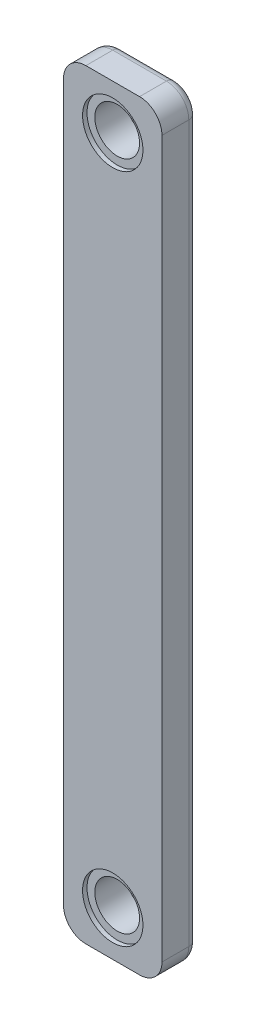
from build123d import *

# Parameters (mm, degrees)
SKETCH1_W           = 22
SKETCH1_H           = 170
BOSS_EXTRUDE1_DEPTH = 4
FILLET1_R           = 5
FILLET2_R           = 2
SKETCH2_R           = 5
CUT_EXTRUDE1_DEPTH  = 87.081356867
SKETCH3_R           = 6.75
CUT_EXTRUDE2_DEPTH  = 1


with BuildPart() as part:
    # Sketch1 → Boss-Extrude1 (new, symmetric)
    with BuildSketch(Plane.XY):
        Rectangle(SKETCH1_W, SKETCH1_H)
    extrude(amount=BOSS_EXTRUDE1_DEPTH, both=True)

    # Fillet1
    fillet1_edges = [part.edges().sort_by_distance(p)[0] for p in [
        (11, -85, 0),
        (-11, -85, 0),
        (-11, 85, 0),
        (11, 85, 0),
    ]]
    fillet(fillet1_edges, radius=FILLET1_R)

    # Fillet2
    fillet2_edges = [part.edges().sort_by_distance(p)[0] for p in [
        (11, 0, -4),
        (0, -85, -4),
        (-11, 0, -4),
        (0, 85, -4),
        (9.535533906, 83.535533906, -4),
        (-9.535533906, 83.535533906, -4),
        (-9.535533906, -83.535533906, -4),
        (9.535533906, -83.535533906, -4),
    ]]
    fillet(fillet2_edges, radius=FILLET2_R)

    # Sketch2 → Cut-Extrude1 (cut, through all)
    with BuildSketch(Plane.XY.offset(4)):
        with Locations((0, 75)):
            Circle(SKETCH2_R)
        with Locations((0, -75)):
            Circle(SKETCH2_R)
    extrude(amount=-CUT_EXTRUDE1_DEPTH, mode=Mode.SUBTRACT)

    # Sketch3 → Cut-Extrude2 (cut)
    with BuildSketch(Plane.XY.offset(4)):
        with Locations((0, 75)):
            Circle(SKETCH3_R)
        with Locations((0, -75)):
            Circle(SKETCH3_R)
    extrude(amount=-CUT_EXTRUDE2_DEPTH, mode=Mode.SUBTRACT)


solid = part.part
